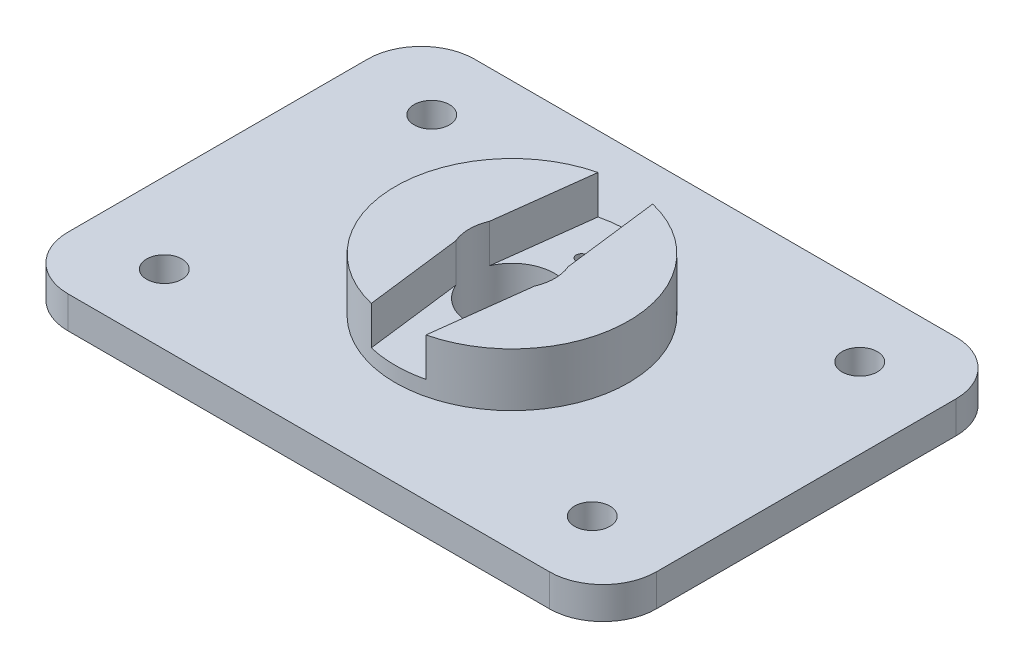
from build123d import *

# Parameters (mm, degrees)
SKETCH_1_W          = 55
SKETCH_1_H          = 38
EXTRUDE_1_DEPTH     = 3
SKETCH_2_R          = 10.9
EXTRUDE_2_DEPTH     = 5
SKETCH_3_R          = 4
CUT_EXTRUDE_1_DEPTH = 35.369317712
CUT_EXTRUDE_2_DEPTH = 3.6
SKETCH_5_R          = 0.5
CUT_EXTRUDE_3_DEPTH = 4
FILLET_1_R          = 5
FILLET_2_R          = 5
FILLET_3_R          = 5
FILLET_4_R          = 5
SKETCH_6_R          = 1.65
CUT_EXTRUDE_4_DEPTH = 35.369317712


with BuildPart() as part:
    # 草图1 → 凸台-拉伸1 (new body)
    with BuildSketch(Plane(origin=(0, 0, 0), x_dir=(1, 0, 0), z_dir=(0, 1, 0))):
        Rectangle(SKETCH_1_W, SKETCH_1_H)
    extrude(amount=EXTRUDE_1_DEPTH)

    # 草图2 → 凸台-拉伸2 (add)
    with BuildSketch(Plane(origin=(0, 3, 0), x_dir=(1, 0, 0), z_dir=(0, 1, 0))):
        with Locations(Location((0, 0, 0), (0, 0, 270))):
            Circle(SKETCH_2_R)
    extrude(amount=EXTRUDE_2_DEPTH)

    # 草图3 → 切除-拉伸1 (cut, through all)
    with BuildSketch(Plane.XZ):
        with Locations(Location((0, 0, 0), (0, 0, 270))):
            Circle(SKETCH_3_R)
    extrude(amount=-CUT_EXTRUDE_1_DEPTH, mode=Mode.SUBTRACT)

    # 草图4 → 切除-拉伸2 (cut)
    with BuildSketch(Plane(origin=(0, 8, 0), x_dir=(1, 0, 0), z_dir=(0, 1, 0))):
        Polygon((3.674809939, -1.579801226), (2.341337155, -12.320336373), (-2.341337155, -12.320336373), (-3.674809939, -1.579801226), align=None)
        Polygon((-3.674809939, 1.579801226), (-2.341337155, 12.320336373), (2.341337155, 12.320336373), (3.674809939, 1.579801226), align=None)
    extrude(amount=-CUT_EXTRUDE_2_DEPTH, mode=Mode.SUBTRACT)

    # 草图5 → 切除-拉伸3 (cut)
    with BuildSketch(Plane(origin=(0, 4.4, 0), x_dir=(1, 0, 0), z_dir=(0, 1, 0))):
        with Locations(Location((0, -6.5, 0), (0, 0, 270))):
            Circle(SKETCH_5_R)
        with Locations(Location((0, 6.5, 0), (0, 0, 270))):
            Circle(SKETCH_5_R)
    extrude(amount=-CUT_EXTRUDE_3_DEPTH, mode=Mode.SUBTRACT)

    # 圆角1
    fillet_1_edges = [part.edges().sort_by_distance(p)[0] for p in [
        (27.5, 1.5, 19),
    ]]
    fillet(fillet_1_edges, radius=FILLET_1_R)

    # 圆角2
    fillet_2_edges = [part.edges().sort_by_distance(p)[0] for p in [
        (-27.5, 1.5, 19),
    ]]
    fillet(fillet_2_edges, radius=FILLET_2_R)

    # 圆角3
    fillet_3_edges = [part.edges().sort_by_distance(p)[0] for p in [
        (-27.5, 1.5, -19),
    ]]
    fillet(fillet_3_edges, radius=FILLET_3_R)

    # 圆角4
    fillet_4_edges = [part.edges().sort_by_distance(p)[0] for p in [
        (27.5, 1.5, -19),
    ]]
    fillet(fillet_4_edges, radius=FILLET_4_R)

    # 草图6 → 切除-拉伸4 (cut, through all)
    with BuildSketch(Plane.XZ):
        with Locations(Location((-20, 12.5, 0), (0, 0, 270))):
            Circle(SKETCH_6_R)
        with Locations(Location((20, 12.5, 0), (0, 0, 270))):
            Circle(SKETCH_6_R)
        with Locations(Location((20, -12.5, 0), (0, 0, 270))):
            Circle(SKETCH_6_R)
        with Locations(Location((-20, -12.5, 0), (0, 0, 270))):
            Circle(SKETCH_6_R)
    extrude(amount=-CUT_EXTRUDE_4_DEPTH, mode=Mode.SUBTRACT)


solid = part.part
